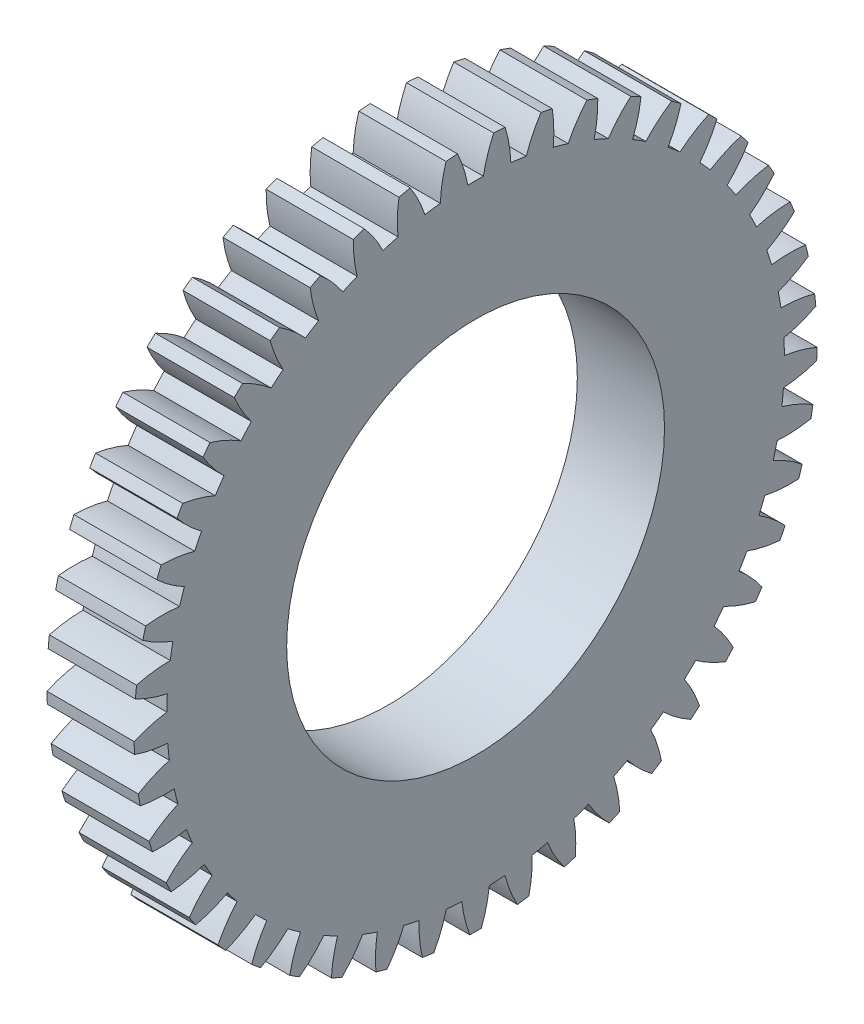
from build123d import *

# Parameters (mm, degrees)
BASPROSKE_W     = 6
BASPROSKE_H     = 23.5
TOOTHCUT_DEPTH  = 34.771289582
TEETHCUTS_COUNT = 45
TEETHCUTS_ANGLE = 352
BORSKE_R        = 13
BORE_DEPTH      = 50.0000508


with BuildPart() as part:
    # BasProSke → Base-Revolve (revolve)
    with BuildSketch(Plane(origin=(0, 0, 0), x_dir=(1, 0, 0), z_dir=(0, 1, 0)), mode=Mode.PRIVATE) as base_revolve_sk:
        with Locations((3, 11.75)):
            Rectangle(BASPROSKE_W, BASPROSKE_H)
    revolve(base_revolve_sk.sketch.rotate(Axis((-10, 0, 0), (1, 0, 0)), 180), axis=Axis((-10, 0, 0), (1, 0, 0)))

    # TooCutSke → ToothCut (cut, through all)
    with BuildSketch(Plane(origin=(0, 0, 0), x_dir=(0, 0, -1), z_dir=(1, 0, 0))):
        with BuildLine():
            ThreePointArc((0.536377412, 21.242229174), (0, 21.249), (-0.536377412, 21.242229174))
            ThreePointArc((-0.536377412, 21.242229174), (-0.821433542, 22.390736361), (-1.254708979, 23.491916706))
            ThreePointArc((-1.254708979, 23.491916706), (0, 23.5254), (1.254708979, 23.491916706))
            ThreePointArc((1.254708979, 23.491916706), (0.821433542, 22.390736361), (0.536377412, 21.242229174))
        make_face()
    toothcut = extrude(amount=TOOTHCUT_DEPTH, mode=Mode.SUBTRACT)

    # TeethCuts: ToothCut ×45 about axis
    teethcuts_axis = Axis((-10, 0, 0), (1, 0, 0))
    for i in range(1, TEETHCUTS_COUNT):
        add(toothcut.rotate(teethcuts_axis, i * TEETHCUTS_ANGLE / (TEETHCUTS_COUNT - 1)), mode=Mode.SUBTRACT)

    # BorSke → Bore (cut, symmetric)
    with BuildSketch(Plane(origin=(0, 0, 0), x_dir=(0, 0, -1), z_dir=(1, 0, 0))):
        with Locations(Location((0, 0, 0), (0, 0, 180))):
            Circle(BORSKE_R)
    extrude(amount=BORE_DEPTH, both=True, mode=Mode.SUBTRACT)


solid = part.part
